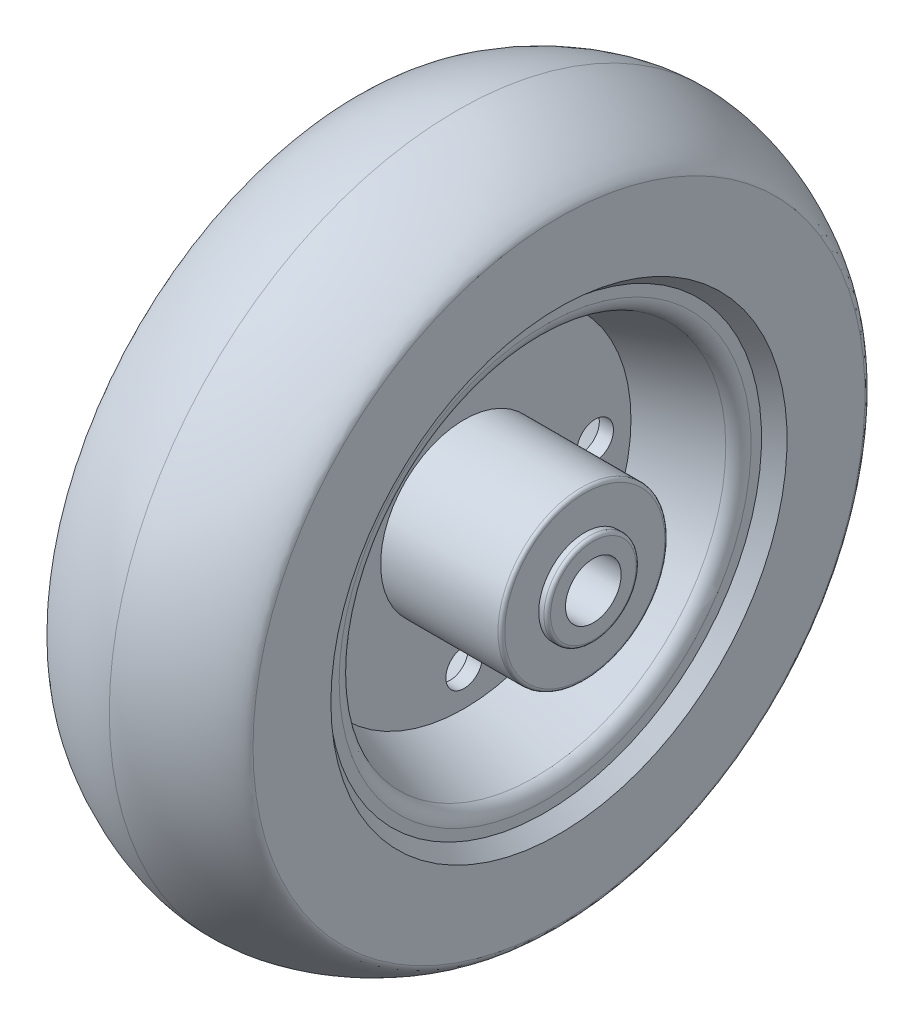
from build123d import *

# Parameters (mm, degrees)
SKETCH8_R            = 19.05
BOSS_EXTRUDE1_DEPTH  = 27.5463
SKETCH9_R            = 10.5156
BOSS_EXTRUDE2_DEPTH  = 1.9558
FILLET4_R            = 0.762
FILLET4_OF_MIRROR2_R = 0.762
SKETCH10_R           = 6.35
CUT_EXTRUDE5_DEPTH   = 129.348565172
SKETCH11_R           = 4.1656
CUT_EXTRUDE6_DEPTH   = 117.926886216


with BuildPart() as part:
    # Sketch5 → Revolve1 (revolve)
    with BuildSketch(Plane.XY):
        with BuildLine():
            Line((-23.2791, 0), (-23.2791, 69.85))
            add(Edge.make_bspline(
                [(-23.2791, 69.85), (-23.2791, 72.067965362), (-10.536247667, 79.375), (0, 79.375)],
                knots=[0, 0, 0, 0, 1, 1, 1, 1], degree=3))
            add(Edge.make_bspline(
                [(23.2791, 69.85), (23.2791, 72.067965362), (10.536247667, 79.375), (0, 79.375)],
                knots=[0, 0, 0, 0, 1, 1, 1, 1], degree=3))
            Line((23.2791, 69.85), (23.2791, 0))
            Line((23.2791, 0), (-23.2791, 0))
        make_face()
    revolve(axis=Axis((-23.2791, 0, 0), (1, 0, 0)))

    # Sketch7 → Cut-Revolve2 (revolve, cut)
    with BuildSketch(Plane(origin=(0, 0, 0), x_dir=(1, 0, 0), z_dir=(0, 1, 0)), mode=Mode.PRIVATE) as cut_revolve2_sk:
        with BuildLine():
            Line((1.6129, 0), (1.6129, 38.1))
            Line((1.6129, 38.1), (17.706481409, 43.645004128))
            ThreePointArc((17.706481409, 43.645004128), (19.443297773, 44.942345392), (20.1041, 47.007040492))
            Line((20.1041, 47.007040492), (20.1041, 49.412815204))
            Line((20.1041, 49.412815204), (23.2791, 52.07))
            Line((23.2791, 52.07), (23.2791, 0))
            Line((23.2791, 0), (1.6129, 0))
        make_face()
    cut_revolve2 = revolve(cut_revolve2_sk.sketch.rotate(Axis((-1000, 0, 0), (1, 0, 0)), 180), axis=Axis((-1000, 0, 0), (1, 0, 0)), mode=Mode.SUBTRACT)

    # Mirror1: Cut-Revolve2 across plane
    add(cut_revolve2.mirror(Plane(origin=(0, 0, 0), x_dir=(0, 0, 1), z_dir=(1, 0, 0))), mode=Mode.SUBTRACT)

    # Sketch8 → Boss-Extrude1 (add)
    with BuildSketch(Plane(origin=(1.6129, 0, 0), x_dir=(0, 0, -1), z_dir=(1, 0, 0))):
        Circle(SKETCH8_R)
    boss_extrude1 = extrude(amount=BOSS_EXTRUDE1_DEPTH)

    # Sketch9 → Boss-Extrude2 (add)
    with BuildSketch(Plane(origin=(29.1592, 0, 0), x_dir=(0, 0, -1), z_dir=(1, 0, 0))):
        Circle(SKETCH9_R)
    boss_extrude2 = extrude(amount=BOSS_EXTRUDE2_DEPTH)

    # Fillet4
    fillet4_edges = [part.edges().sort_by_distance(p)[0] for p in [
        (29.1592, 0, 19.05),
        (31.115, 0, 10.5156),
    ]]
    fillet(fillet4_edges, radius=FILLET4_R)

    # Mirror2: Boss-Extrude1, Boss-Extrude2 across plane
    add(boss_extrude1.mirror(Plane(origin=(0, 0, 0), x_dir=(0, 0, 1), z_dir=(1, 0, 0))))
    add(boss_extrude2.mirror(Plane(origin=(0, 0, 0), x_dir=(0, 0, 1), z_dir=(1, 0, 0))))

    # Fillet4 of Mirror2
    fillet4_of_mirror2_edges = [part.edges().sort_by_distance(p)[0] for p in [
        (-29.1592, 0, 19.05),
        (-31.115, 0, 10.5156),
    ]]
    fillet(fillet4_of_mirror2_edges, radius=FILLET4_OF_MIRROR2_R)

    # Sketch10 → Cut-Extrude5 (cut, through all)
    with BuildSketch(Plane.ZY.offset(31.115)):
        Circle(SKETCH10_R)
    extrude(amount=-CUT_EXTRUDE5_DEPTH, mode=Mode.SUBTRACT)

    # Sketch11 → Cut-Extrude6 (cut, through all)
    with BuildSketch(Plane(origin=(1.6129, 0, 0), x_dir=(0, 0, -1), z_dir=(1, 0, 0))):
        with Locations((0, 29.9339)):
            Circle(SKETCH11_R)
        with Locations((29.9339, 0)):
            Circle(SKETCH11_R)
        with Locations((0, -29.9339)):
            Circle(SKETCH11_R)
        with Locations((-29.9339, 0)):
            Circle(SKETCH11_R)
    extrude(amount=-CUT_EXTRUDE6_DEPTH, mode=Mode.SUBTRACT)


solid = part.part
